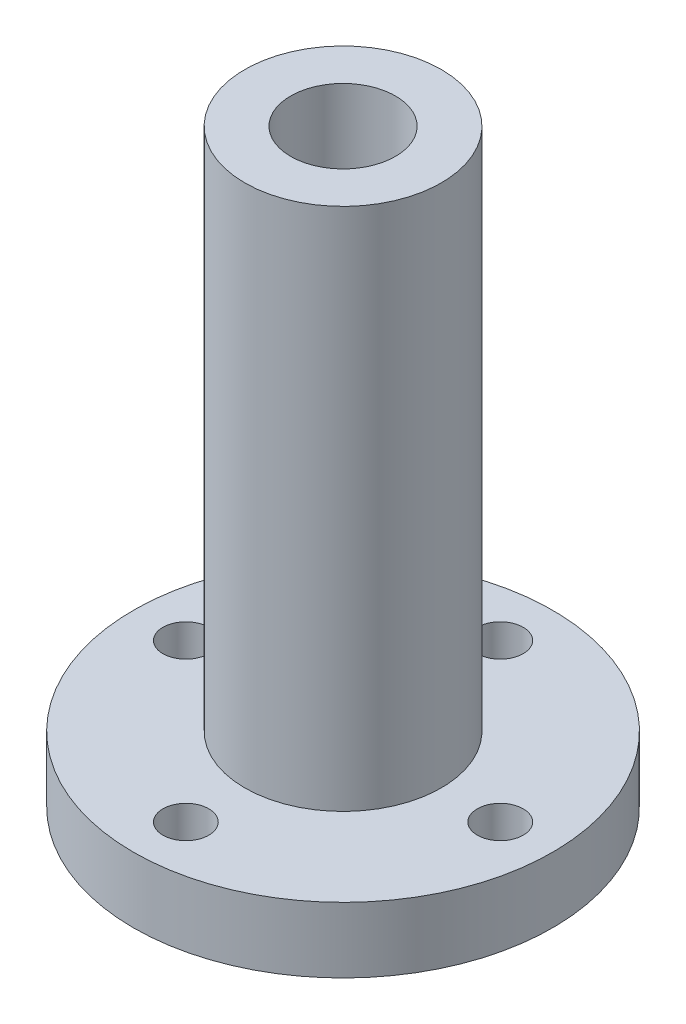
from build123d import *

# Parameters (mm, degrees)
SKETCH_1_R      = 16
SKETCH_1_R_2    = 4
SKETCH_1_R_3    = 1.75
EXTRUDE_1_DEPTH = 5
SKETCH_2_R      = 7.5
SKETCH_2_R_2    = 4
EXTRUDE_2_DEPTH = 40


with BuildPart() as part:
    # 草图1 → 凸台-拉伸1 (new body)
    with BuildSketch(Plane(origin=(0, 0, 0), x_dir=(1, 0, 0), z_dir=(0, 1, 0))):
        with Locations(Location((0, 0, 0), (0, 0, 270))):
            Circle(SKETCH_1_R)
        with Locations(Location((0, 0, 0), (0, 0, 270))):
            Circle(SKETCH_1_R_2, mode=Mode.SUBTRACT)
        with Locations(Location((0, 12, 0), (0, 0, 270))):
            Circle(SKETCH_1_R_3, mode=Mode.SUBTRACT)
        with Locations(Location((-12, 0, 0), (0, 0, 270))):
            Circle(SKETCH_1_R_3, mode=Mode.SUBTRACT)
        with Locations(Location((12, 0, 0), (0, 0, 270))):
            Circle(SKETCH_1_R_3, mode=Mode.SUBTRACT)
        with Locations(Location((0, -12, 0), (0, 0, 270))):
            Circle(SKETCH_1_R_3, mode=Mode.SUBTRACT)
    extrude(amount=EXTRUDE_1_DEPTH)

    # 草图2 → 凸台-拉伸2 (add)
    with BuildSketch(Plane(origin=(0, 5, 0), x_dir=(1, 0, 0), z_dir=(0, 1, 0))):
        with Locations(Location((0, 0, 0), (0, 0, 270))):
            Circle(SKETCH_2_R)
        with Locations(Location((0, 0, 0), (0, 0, 270))):
            Circle(SKETCH_2_R_2, mode=Mode.SUBTRACT)
    extrude(amount=EXTRUDE_2_DEPTH)


solid = part.part
